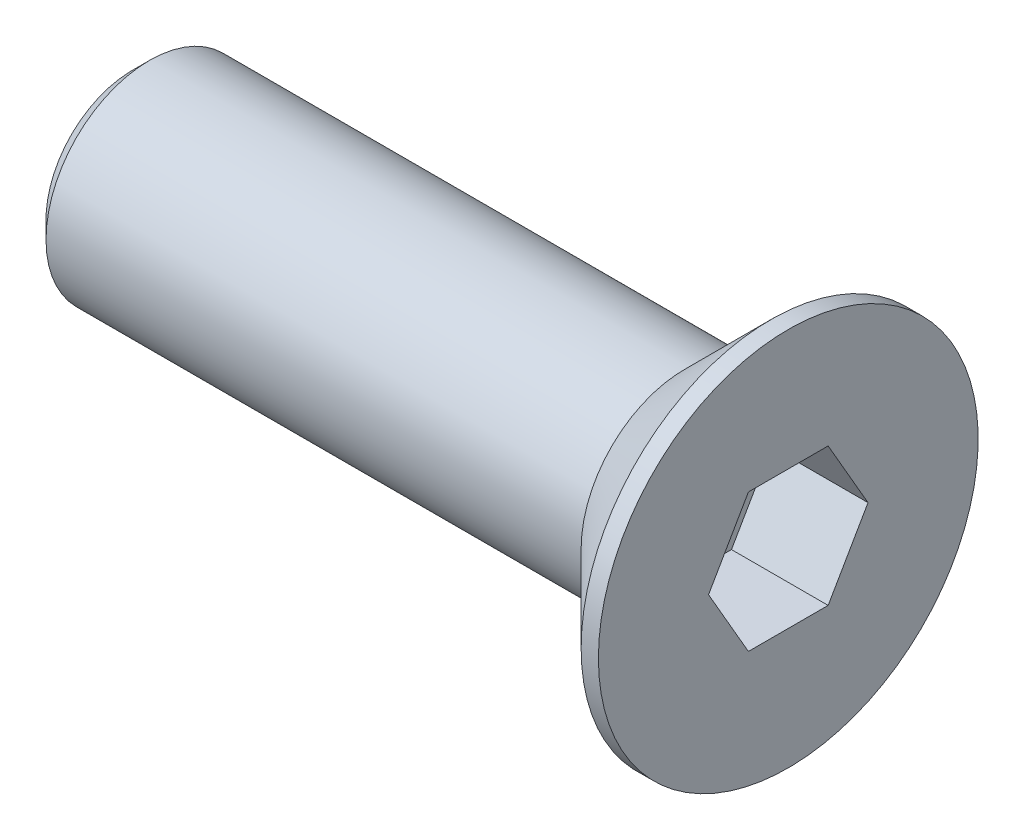
from build123d import *

# Parameters (mm, degrees)
CHANFREIN2_SIZE         = 0.5
EMPREINTE_POUR_CL_DEPTH = 2.8


with BuildPart() as part:
    # Esquisse1 → Base-Révolution (revolve)
    with BuildSketch(Plane.XY, mode=Mode.PRIVATE) as base_r_volution_sk:
        Polygon((0, 0), (0, 3), (16, 3), (18.5, 5.5), (19, 5.5), (19, 0), align=None)
    revolve(base_r_volution_sk.sketch.rotate(Axis((-25.828475034, 0, 0), (1, 0, 0)), 90), axis=Axis((-25.828475034, 0, 0), (1, 0, 0)))

    # Chanfrein2
    chanfrein2_edges = [part.edges().sort_by_distance(p)[0] for p in [
        (0, 0, -3),
    ]]
    chamfer(chanfrein2_edges, length=CHANFREIN2_SIZE)

    # Esquisse2 → Empreinte pour clé (cut)
    with BuildSketch(Plane(origin=(19, 0, 0), x_dir=(0, 0, -1), z_dir=(1, 0, 0))):
        Polygon((2.309401077, 0), (1.154700538, 2), (-1.154700538, 2), (-2.309401077, 0), (-1.154700538, -2), (1.154700538, -2), align=None)
    extrude(amount=-EMPREINTE_POUR_CL_DEPTH, mode=Mode.SUBTRACT)


solid = part.part
